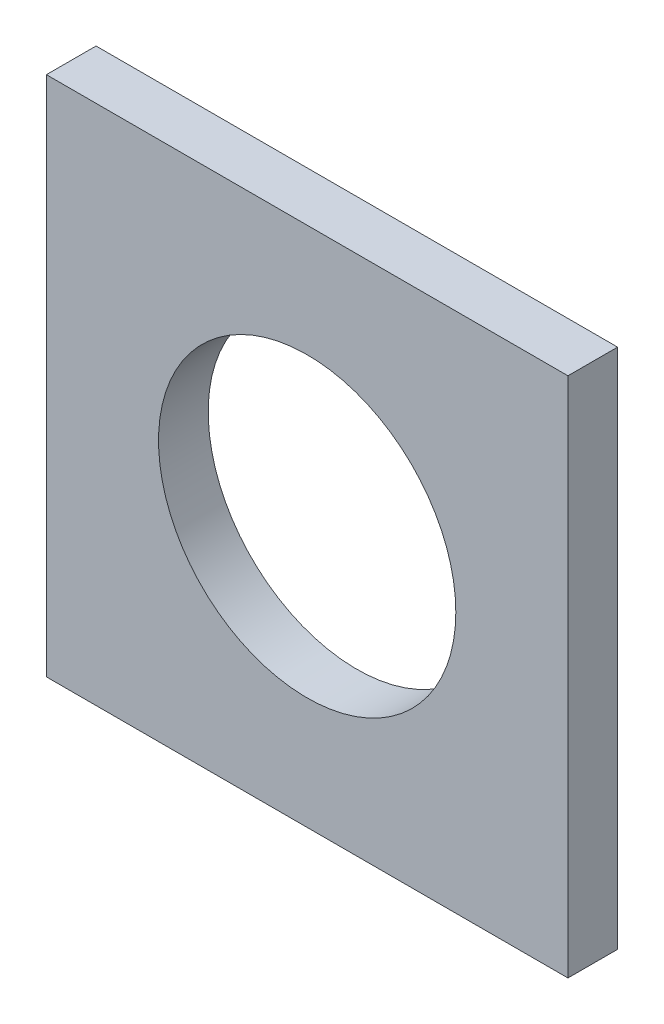
from build123d import *

# Parameters (mm, degrees)
ESBO_O1_W                = 50
ESBO_O1_H                = 50
ESBO_O1_R                = 14.25
RESSALTO_EXTRUS_O1_DEPTH = 4.76


with BuildPart() as part:
    # Esboço1 → Ressalto-extrusão1 (new body)
    with BuildSketch(Plane.XY):
        Rectangle(ESBO_O1_W, ESBO_O1_H)
        Circle(ESBO_O1_R, mode=Mode.SUBTRACT)
    extrude(amount=RESSALTO_EXTRUS_O1_DEPTH)


solid = part.part
